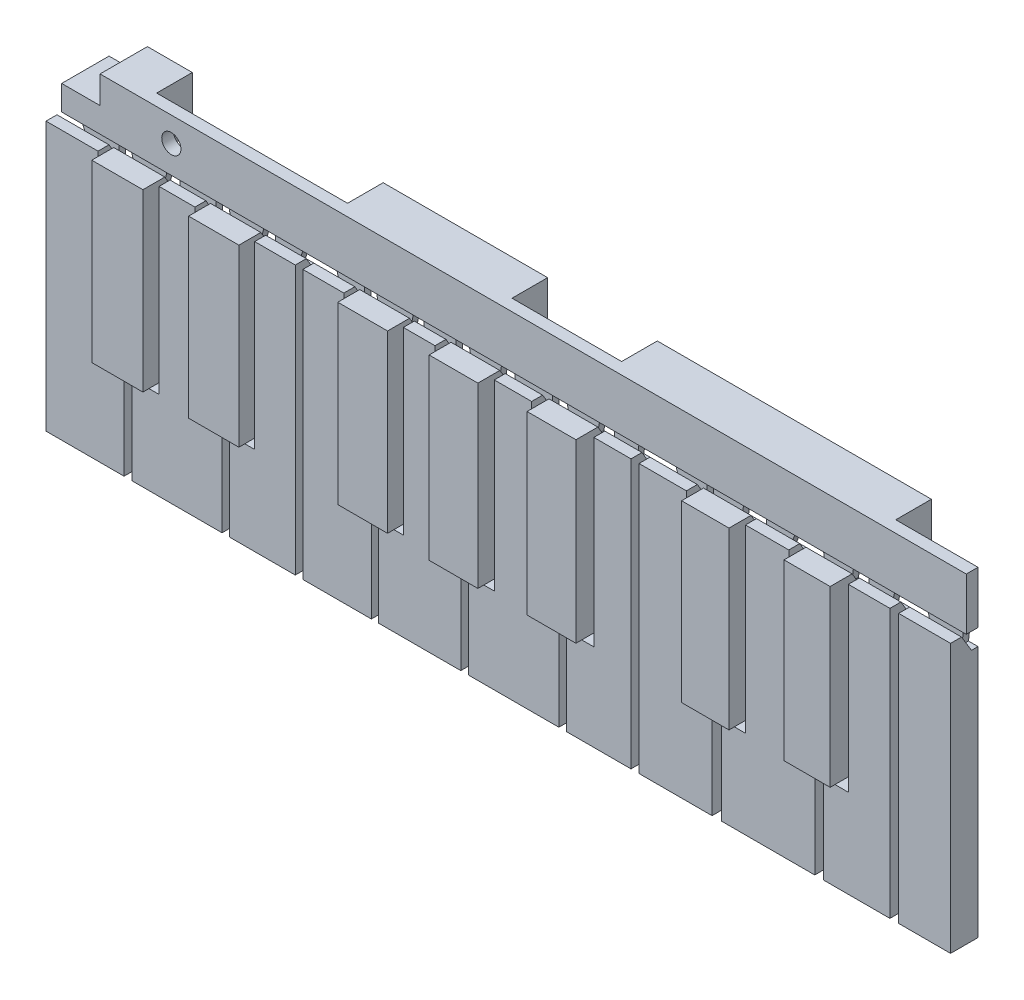
from build123d import *

# Parameters (mm, degrees)
SKETCH_1_W          = 165
SKETCH_1_H          = 60
EXTRUDE_1_DEPTH     = 5
SKETCH_2_R          = 1.75
CUT_EXTRUDE_1_DEPTH = 30
SKETCH_3_W          = 1.38170368
SKETCH_3_H          = 48.979021899
SKETCH_3_W_2        = 1.46653497
SKETCH_3_W_3        = 1.594244514
CUT_EXTRUDE_2_DEPTH = 30
SKETCH_4_W          = 9.327115347
SKETCH_4_H          = 31.967151887
SKETCH_4_W_2        = 9.171037529
SKETCH_4_H_2        = 31.924805175
SKETCH_4_W_3        = 9.079327154
SKETCH_4_W_4        = 8.895906403
SKETCH_4_H_3        = 32.439592125
SKETCH_4_W_5        = 8.915859646
SKETCH_4_H_4        = 32.154758308
SKETCH_4_W_6        = 8.642925167
SKETCH_4_H_5        = 31.886752984
SKETCH_4_W_7        = 8.41151919
SKETCH_4_H_6        = 31.725955179
EXTRUDE_2_DEPTH     = 2
CUT_EXTRUDE_3_DEPTH = 180
CUT_EXTRUDE_4_DEPTH = 1.2
SKETCH_7_W          = 50
SKETCH_7_H          = 11.020978101
SKETCH_7_W_2        = 30
SKETCH_7_W_3        = 15.183731112
EXTRUDE_5_DEPTH     = 6.5
SKETCH_9_W          = 7
SKETCH_9_H          = 6.5
CUT_EXTRUDE_6_DEPTH = 24
SKETCH_10_W         = 158
SKETCH_10_H         = 1.5
CUT_EXTRUDE_7_DEPTH = 10


with BuildPart() as part:
    # 草图1 → 凸台-拉伸1 (new body)
    with BuildSketch(Plane.XY):
        with Locations((9.888137082, 3.357456811)):
            Rectangle(SKETCH_1_W, SKETCH_1_H)
    extrude(amount=EXTRUDE_1_DEPTH)

    # 草图2 → 切除-拉伸1 (cut)
    with BuildSketch(Plane.XY.offset(5)):
        with Locations((-52.611862918, 27.357456811)):
            Circle(SKETCH_2_R)
    extrude(amount=-CUT_EXTRUDE_1_DEPTH, mode=Mode.SUBTRACT)

    # 草图3 → 切除-拉伸2 (cut)
    with BuildSketch(Plane.XY.offset(5)):
        Polygon((-62.265802377, -9.630673177), (-62.265802377, 22.33647871), (-63.123073014, 22.33647871), (-63.123073014, -10.529090493), (-58.37669152, -10.529090493), (-58.37669152, -26.642543189), (-56.923893564, -26.642543189), (-56.923893564, -10.529090493), (-51.985942813, -10.529090493), (-51.985942813, 22.33647871), (-52.93868703, 22.33647871), (-52.93868703, -9.630673177), align=None)
        Polygon((-44.597450435, -9.588326465), (-44.597450435, 22.33647871), (-45.446880241, 22.33647871), (-45.446880241, -10.504323689), (-40.497360349, -10.504323689), (-40.497360349, -26.642543189), (-39.140253714, -26.642543189), (-39.140253714, -10.504323689), (-34.546836553, -10.504323689), (-34.546836553, 22.33647871), (-35.426412906, 22.33647871), (-35.426412906, -9.588326465), align=None)
        with Locations((-26.449176316, -2.153032239)):
            Rectangle(SKETCH_3_W, SKETCH_3_H)
        Polygon((-17.39138435, -9.630673177), (-17.39138435, 22.33647871), (-18.28768083, 22.33647871), (-18.28768083, -10.471849657), (-13.263442322, -10.471849657), (-13.263442322, -26.642543189), (-11.98582464, -26.642543189), (-11.98582464, -10.471849657), (-7.430435981, -10.471849657), (-7.430435981, 22.33647871), (-8.312057196, 22.33647871), (-8.312057196, -9.630673177), align=None)
        Polygon((-0.732768776, -10.103113415), (-0.732768776, 22.33647871), (-1.655760192, 22.33647871), (-1.655760192, -11.017051739), (3.050485552, -11.017051739), (3.050485552, -26.642543189), (4.418795704, -26.642543189), (4.418795704, -11.017051739), (9.157950343, -11.017051739), (9.157950343, 22.33647871), (8.163137627, 22.33647871), (8.163137627, -10.103113415), align=None)
        Polygon((17.135420759, -9.818279598), (17.135420759, 22.33647871), (15.963652638, 22.33647871), (15.963652638, -10.753368058), (20.932498022, -10.753368058), (20.932498022, -26.642543189), (22.310413129, -26.642543189), (22.310413129, -10.753368058), (27.321013517, -10.753368058), (27.321013517, 22.33647871), (26.051280405, 22.33647871), (26.051280405, -9.818279598), align=None)
        with Locations((34.827479838, -2.153032239)):
            Rectangle(SKETCH_3_W_2, SKETCH_3_H)
        Polygon((45.323246015, -9.550274274), (45.323246015, 22.33647871), (44.198629509, 22.33647871), (44.198629509, -10.573289809), (48.875236236, -10.573289809), (48.875236236, -26.642543189), (50.595342158, -26.642543189), (50.595342158, -10.573289809), (54.975956264, -10.573289809), (54.975956264, 22.33647871), (53.966171182, 22.33647871), (53.966171182, -9.550274274), align=None)
        Polygon((64.010105458, 22.33647871), (62.870909569, 22.33647871), (62.870909569, -10.510672056), (67.611689306, -10.510672056), (67.611689306, -26.642543189), (69.247887622, -26.642543189), (69.247887622, -10.510672056), (73.736944541, -10.510672056), (73.736944541, 22.33647871), (72.421624648, 22.33647871), (72.421624648, -9.389476469), (64.010105458, -9.389476469), align=None)
        with Locations((82.118578852, -2.153032239)):
            Rectangle(SKETCH_3_W_3, SKETCH_3_H)
    extrude(amount=-CUT_EXTRUDE_2_DEPTH, mode=Mode.SUBTRACT)

    # 草图4 → 凸台-拉伸2 (add)
    with BuildSketch(Plane.XY.offset(5)):
        with Locations((-57.602244704, 6.352902767)):
            Rectangle(SKETCH_4_W, SKETCH_4_H)
        with Locations((-40.011931671, 6.374076123)):
            Rectangle(SKETCH_4_W_2, SKETCH_4_H_2)
        with Locations((-12.851720773, 6.352902767)):
            Rectangle(SKETCH_4_W_3, SKETCH_4_H)
        with Locations((3.715184426, 6.116682648)):
            Rectangle(SKETCH_4_W_4, SKETCH_4_H_3)
        with Locations((21.593350582, 6.259099556)):
            Rectangle(SKETCH_4_W_5, SKETCH_4_H_4)
        with Locations((49.644708599, 6.393102218)):
            Rectangle(SKETCH_4_W_6, SKETCH_4_H_5)
        with Locations((68.215865053, 6.473501121)):
            Rectangle(SKETCH_4_W_7, SKETCH_4_H_6)
    extrude(amount=EXTRUDE_2_DEPTH)

    # 草图5 → 切除-拉伸3 (cut)
    with BuildSketch(Plane.ZY.offset(72.611862918)):
        Polygon((3, 22.33647871), (5, 22.33647871), (5, 33.357456811), (2.139396649, 33.357456811), (2.139396649, 22.33647871), (1.2, 22.33647871), (1.2, 19.33647871), align=None)
    extrude(amount=-CUT_EXTRUDE_3_DEPTH, mode=Mode.SUBTRACT)

    # 草图6 → 切除-拉伸4 (cut)
    with BuildSketch(Plane(origin=(0, 0, 0), x_dir=(-1, 0, 0), z_dir=(0, 0, -1))):
        Polygon((-90.645601292, 19.33647871), (-91.005651898, 22.33647871), (-92.388137082, 22.33647871), (-92.388137082, 19.33647871), align=None)
        Polygon((-78.552811005, 22.33647871), (-82.915701109, 22.33647871), (-84.464437491, 22.33647871), (-84.806593659, 19.33647871), (-77.906649015, 19.33647871), align=None)
        Polygon((-70.986855952, 22.33647871), (-72.421624648, 22.33647871), (-72.421624648, 19.33647871), (-70.574674606, 19.33647871), align=None)
        Polygon((-64.010105458, 22.33647871), (-65.334337999, 22.33647871), (-65.660598914, 19.33647871), (-64.010105458, 19.33647871), align=None)
        Polygon((-31.853246388, 22.33647871), (-38.233007072, 22.33647871), (-39.184199433, 19.33647871), (-31.429682061, 19.33647871), align=None)
        Polygon((-24.733695559, 22.33647871), (-26.051280405, 22.33647871), (-26.051280405, 19.33647871), (-24.130795443, 19.33647871), align=None)
        Polygon((-17.135420759, 22.33647871), (-18.561162327, 22.33647871), (-19.010747721, 19.33647871), (-17.135420759, 19.33647871), align=None)
        Polygon((-6.79963767, 22.33647871), (-8.163137627, 22.33647871), (-8.163137627, 19.33647871), (-6.330153324, 19.33647871), align=None)
        Polygon((0.732768776, 22.33647871), (-0.682869209, 22.33647871), (-1.213678005, 19.33647871), (0.732768776, 19.33647871), align=None)
        Polygon((9.234702145, 22.33647871), (8.312057196, 22.33647871), (8.312057196, 19.33647871), (9.854654927, 19.33647871), align=None)
        Polygon((17.39138435, 22.33647871), (16.207269141, 22.33647871), (15.722041192, 19.33647871), (17.39138435, 19.33647871), align=None)
        Polygon((29.296364848, 22.33647871), (23.621368572, 22.33647871), (22.710280463, 19.33647871), (30.268697355, 19.33647871), align=None)
        Polygon((36.445719439, 22.33647871), (35.426412906, 22.33647871), (35.426412906, 19.33647871), (37.245308622, 19.33647871), align=None)
        Polygon((44.597450435, 22.33647871), (43.140232346, 22.33647871), (42.611007796, 19.33647871), (44.597450435, 19.33647871), align=None)
        Polygon((54.126462046, 22.33647871), (52.93868703, 22.33647871), (52.93868703, 19.33647871), (54.893867233, 19.33647871), align=None)
        Polygon((62.265802377, 22.33647871), (61.038545607, 22.33647871), (60.227303121, 19.33647871), (62.265802377, 19.33647871), align=None)
        Polygon((72.611862918, 22.33647871), (70.118531231, 22.33647871), (68.834076345, 19.33647871), (72.611862918, 19.33647871), align=None)
        Polygon((-60.580992314, 22.33647871), (-62.870909569, 22.33647871), (-62.870909569, 19.33647871), (-59.293843404, 19.33647871), align=None)
        Polygon((-50.933442478, 22.33647871), (-53.966171182, 22.33647871), (-53.966171182, 19.33647871), (-50.546926868, 19.33647871), align=None)
    extrude(amount=-CUT_EXTRUDE_4_DEPTH, mode=Mode.SUBTRACT)

    # 草图7 → 凸台-拉伸5 (add)
    with BuildSketch(Plane(origin=(0, 0, 0), x_dir=(-1, 0, 0), z_dir=(0, 0, -1))):
        with Locations((-52.388137082, 27.846967761)):
            Rectangle(SKETCH_7_W, SKETCH_7_H)
        with Locations((7.611862918, 27.846967761)):
            Rectangle(SKETCH_7_W_2, SKETCH_7_H)
        with Locations((65.019997362, 27.846967761)):
            Rectangle(SKETCH_7_W_3, SKETCH_7_H)
    extrude(amount=EXTRUDE_5_DEPTH)

    # 草图9 → 切除-拉伸6 (cut)
    with BuildSketch(Plane.XY.offset(2.139396649)):
        with Locations((-69.111862918, 30.107456811)):
            Rectangle(SKETCH_9_W, SKETCH_9_H)
    extrude(amount=-CUT_EXTRUDE_6_DEPTH, mode=Mode.SUBTRACT)

    # 草图10 → 切除-拉伸7 (cut)
    with BuildSketch(Plane.XY.offset(2.139396649)):
        with Locations((13.388137082, 32.607456811)):
            Rectangle(SKETCH_10_W, SKETCH_10_H)
    extrude(amount=-CUT_EXTRUDE_7_DEPTH, mode=Mode.SUBTRACT)


solid = part.part
